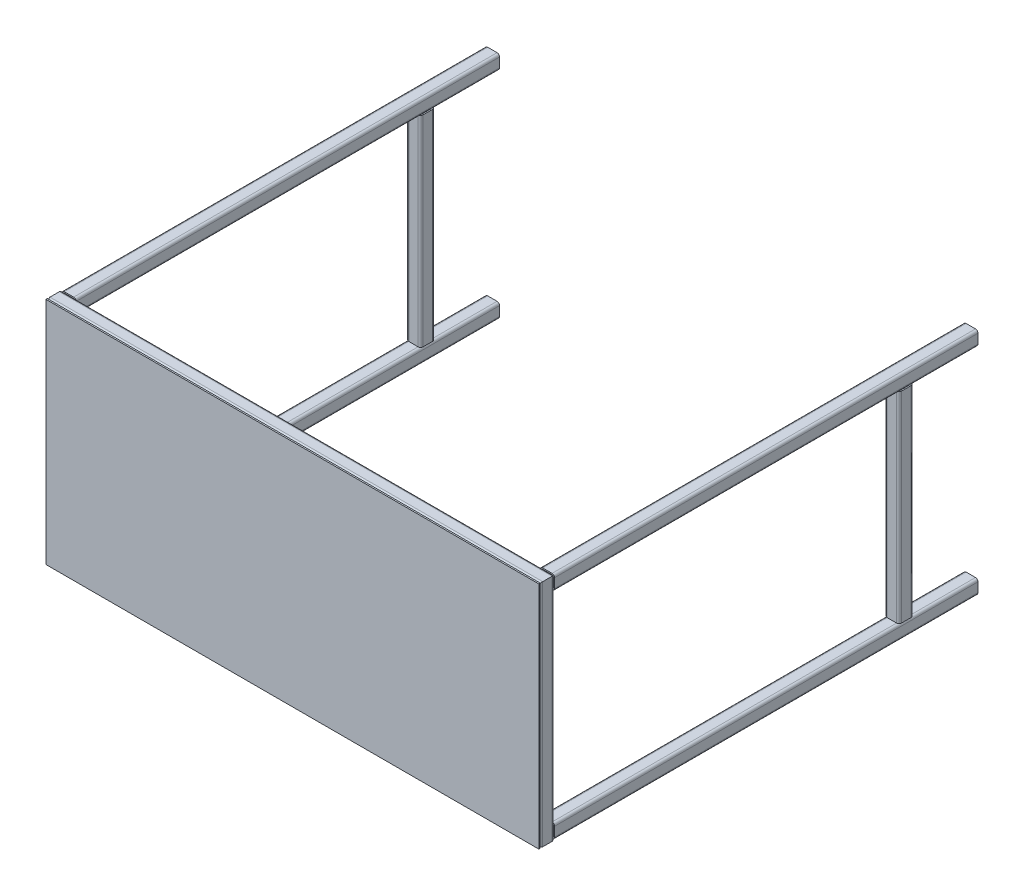
from build123d import *

# Parameters (mm, degrees)
MEMBER_1_DEPTH      = 472.213203436
MEMBER_1_DEPTH_BACK = 22.213203436
MEMBER_1_2_DEPTH    = 1044.426406871
MEMBER_1_3_DEPTH    = 494.426406871
MEMBER_1_4_DEPTH    = 1044.426406871
MEMBER_2_DEPTH      = 900
MEMBER_2_2_DEPTH    = 900
MEMBER_2_3_DEPTH    = 900
MEMBER_2_4_DEPTH    = 900
SKETCH_6_W          = 1030
SKETCH_6_H          = 480
EXTRUDE_1_DEPTH     = 3
MEMBER_3_DEPTH      = 450
MEMBER_3_2_DEPTH    = 450


with BuildPart() as part:
    # Sketch1 → Member 1 (new, two sides: drawn at the far end of the back side and taken through both)
    with BuildSketch(Plane(origin=(500, -225, 0), x_dir=(-1, 0, 0), z_dir=(0, 1, 0)).offset(-MEMBER_1_DEPTH_BACK)):
        with BuildLine():
            Line((-9.8, -15), (9.8, -15))
            ThreePointArc((9.8, -15), (13.476955262, -13.476955262), (15, -9.8))
            Line((15, -9.8), (15, 9.8))
            ThreePointArc((15, 9.8), (13.476955262, 13.476955262), (9.8, 15))
            Line((9.8, 15), (-9.8, 15))
            ThreePointArc((-9.8, 15), (-13.476955262, 13.476955262), (-15, 9.8))
            Line((-15, 9.8), (-15, -9.8))
            ThreePointArc((-15, -9.8), (-13.476955262, -13.476955262), (-9.8, -15))
        make_face()
        with BuildLine():
            Line((-9.8, -12.4), (9.8, -12.4))
            ThreePointArc((9.8, -12.4), (11.638477631, -11.638477631), (12.4, -9.8))
            Line((12.4, -9.8), (12.4, 9.8))
            ThreePointArc((12.4, 9.8), (11.638477631, 11.638477631), (9.8, 12.4))
            Line((9.8, 12.4), (-9.8, 12.4))
            ThreePointArc((-9.8, 12.4), (-11.638477631, 11.638477631), (-12.4, 9.8))
            Line((-12.4, 9.8), (-12.4, -9.8))
            ThreePointArc((-12.4, -9.8), (-11.638477631, -11.638477631), (-9.8, -12.4))
        make_face(mode=Mode.SUBTRACT)
    extrude(amount=MEMBER_1_DEPTH + MEMBER_1_DEPTH_BACK)

    # Member 1 mitre 1
    split(bisect_by=Plane(origin=(500, -225, 0), x_dir=(-0.707106781, 0.707106781, 0), z_dir=(0.707106781, 0.707106781, 0)), keep=Keep.TOP)

    # Member 1 mitre 2
    split(bisect_by=Plane(origin=(500, 225, 0), x_dir=(0.707106781, 0.707106781, 0), z_dir=(0.707106781, -0.707106781, 0)), keep=Keep.TOP)


with BuildPart() as body_2:
    # Sketch1 on segment 2 (carried to segment 2) → Member 1 2 (new body)
    with BuildSketch(Plane(origin=(522.213203436, 225, 0), x_dir=(0, -1, 0), z_dir=(-1, 0, 0))):
        with BuildLine():
            Line((-9.8, -15), (9.8, -15))
            ThreePointArc((9.8, -15), (13.476955262, -13.476955262), (15, -9.8))
            Line((15, -9.8), (15, 9.8))
            ThreePointArc((15, 9.8), (13.476955262, 13.476955262), (9.8, 15))
            Line((9.8, 15), (-9.8, 15))
            ThreePointArc((-9.8, 15), (-13.476955262, 13.476955262), (-15, 9.8))
            Line((-15, 9.8), (-15, -9.8))
            ThreePointArc((-15, -9.8), (-13.476955262, -13.476955262), (-9.8, -15))
        make_face()
        with BuildLine():
            Line((-9.8, -12.4), (9.8, -12.4))
            ThreePointArc((9.8, -12.4), (11.638477631, -11.638477631), (12.4, -9.8))
            Line((12.4, -9.8), (12.4, 9.8))
            ThreePointArc((12.4, 9.8), (11.638477631, 11.638477631), (9.8, 12.4))
            Line((9.8, 12.4), (-9.8, 12.4))
            ThreePointArc((-9.8, 12.4), (-11.638477631, 11.638477631), (-12.4, 9.8))
            Line((-12.4, 9.8), (-12.4, -9.8))
            ThreePointArc((-12.4, -9.8), (-11.638477631, -11.638477631), (-9.8, -12.4))
        make_face(mode=Mode.SUBTRACT)
    extrude(amount=MEMBER_1_2_DEPTH)

    # Member 1 2 mitre 1
    split(bisect_by=Plane(origin=(500, 225, 0), x_dir=(-0.707106781, -0.707106781, 0), z_dir=(-0.707106781, 0.707106781, 0)), keep=Keep.TOP)

    # Member 1 2 mitre 2
    split(bisect_by=Plane(origin=(-500, 225, 0), x_dir=(-0.707106781, 0.707106781, 0), z_dir=(0.707106781, 0.707106781, 0)), keep=Keep.TOP)


with BuildPart() as body_3:
    # Sketch1 on segment 3 (carried to segment 3) → Member 1 3 (new body)
    with BuildSketch(Plane(origin=(-500, 247.213203436, 0), x_dir=(1, 0, 0), z_dir=(0, -1, 0))):
        with BuildLine():
            Line((-9.8, -15), (9.8, -15))
            ThreePointArc((9.8, -15), (13.476955262, -13.476955262), (15, -9.8))
            Line((15, -9.8), (15, 9.8))
            ThreePointArc((15, 9.8), (13.476955262, 13.476955262), (9.8, 15))
            Line((9.8, 15), (-9.8, 15))
            ThreePointArc((-9.8, 15), (-13.476955262, 13.476955262), (-15, 9.8))
            Line((-15, 9.8), (-15, -9.8))
            ThreePointArc((-15, -9.8), (-13.476955262, -13.476955262), (-9.8, -15))
        make_face()
        with BuildLine():
            Line((-9.8, -12.4), (9.8, -12.4))
            ThreePointArc((9.8, -12.4), (11.638477631, -11.638477631), (12.4, -9.8))
            Line((12.4, -9.8), (12.4, 9.8))
            ThreePointArc((12.4, 9.8), (11.638477631, 11.638477631), (9.8, 12.4))
            Line((9.8, 12.4), (-9.8, 12.4))
            ThreePointArc((-9.8, 12.4), (-11.638477631, 11.638477631), (-12.4, 9.8))
            Line((-12.4, 9.8), (-12.4, -9.8))
            ThreePointArc((-12.4, -9.8), (-11.638477631, -11.638477631), (-9.8, -12.4))
        make_face(mode=Mode.SUBTRACT)
    extrude(amount=MEMBER_1_3_DEPTH)

    # Member 1 3 mitre 1
    split(bisect_by=Plane(origin=(-500, -225, 0), x_dir=(-0.707106781, -0.707106781, 0), z_dir=(-0.707106781, 0.707106781, 0)), keep=Keep.TOP)

    # Member 1 3 mitre 2
    split(bisect_by=Plane(origin=(-500, 225, 0), x_dir=(0.707106781, -0.707106781, 0), z_dir=(-0.707106781, -0.707106781, 0)), keep=Keep.TOP)


with BuildPart() as body_4:
    # Sketch1 on segment 4 (carried to segment 4) → Member 1 4 (new body)
    with BuildSketch(Plane(origin=(-522.213203436, -225, 0), x_dir=(0, 1, 0), z_dir=(1, 0, 0))):
        with BuildLine():
            Line((-9.8, -15), (9.8, -15))
            ThreePointArc((9.8, -15), (13.476955262, -13.476955262), (15, -9.8))
            Line((15, -9.8), (15, 9.8))
            ThreePointArc((15, 9.8), (13.476955262, 13.476955262), (9.8, 15))
            Line((9.8, 15), (-9.8, 15))
            ThreePointArc((-9.8, 15), (-13.476955262, 13.476955262), (-15, 9.8))
            Line((-15, 9.8), (-15, -9.8))
            ThreePointArc((-15, -9.8), (-13.476955262, -13.476955262), (-9.8, -15))
        make_face()
        with BuildLine():
            Line((-9.8, -12.4), (9.8, -12.4))
            ThreePointArc((9.8, -12.4), (11.638477631, -11.638477631), (12.4, -9.8))
            Line((12.4, -9.8), (12.4, 9.8))
            ThreePointArc((12.4, 9.8), (11.638477631, 11.638477631), (9.8, 12.4))
            Line((9.8, 12.4), (-9.8, 12.4))
            ThreePointArc((-9.8, 12.4), (-11.638477631, 11.638477631), (-12.4, 9.8))
            Line((-12.4, 9.8), (-12.4, -9.8))
            ThreePointArc((-12.4, -9.8), (-11.638477631, -11.638477631), (-9.8, -12.4))
        make_face(mode=Mode.SUBTRACT)
    extrude(amount=MEMBER_1_4_DEPTH)

    # Member 1 4 mitre 1
    split(bisect_by=Plane(origin=(500, -225, 0), x_dir=(0.707106781, -0.707106781, 0), z_dir=(-0.707106781, -0.707106781, 0)), keep=Keep.TOP)

    # Member 1 4 mitre 2
    split(bisect_by=Plane(origin=(-500, -225, 0), x_dir=(0.707106781, 0.707106781, 0), z_dir=(0.707106781, -0.707106781, 0)), keep=Keep.TOP)


with BuildPart() as body_5:
    # Sketch11 → Member 2 (new body)
    with BuildSketch(Plane(origin=(500, 225, 0), x_dir=(0, 1, 0), z_dir=(0, 0, -1))):
        with BuildLine():
            Line((-9.8, -15), (9.8, -15))
            ThreePointArc((9.8, -15), (13.476955262, -13.476955262), (15, -9.8))
            Line((15, -9.8), (15, 9.8))
            ThreePointArc((15, 9.8), (13.476955262, 13.476955262), (9.8, 15))
            Line((9.8, 15), (-9.8, 15))
            ThreePointArc((-9.8, 15), (-13.476955262, 13.476955262), (-15, 9.8))
            Line((-15, 9.8), (-15, -9.8))
            ThreePointArc((-15, -9.8), (-13.476955262, -13.476955262), (-9.8, -15))
        make_face()
        with BuildLine():
            Line((-9.8, -12.4), (9.8, -12.4))
            ThreePointArc((9.8, -12.4), (11.638477631, -11.638477631), (12.4, -9.8))
            Line((12.4, -9.8), (12.4, 9.8))
            ThreePointArc((12.4, 9.8), (11.638477631, 11.638477631), (9.8, 12.4))
            Line((9.8, 12.4), (-9.8, 12.4))
            ThreePointArc((-9.8, 12.4), (-11.638477631, 11.638477631), (-12.4, 9.8))
            Line((-12.4, 9.8), (-12.4, -9.8))
            ThreePointArc((-12.4, -9.8), (-11.638477631, -11.638477631), (-9.8, -12.4))
        make_face(mode=Mode.SUBTRACT)
    extrude(amount=MEMBER_2_DEPTH)

    # Weld Trim 1 5
    split(bisect_by=Plane(origin=(0, 225.064026667, -15), x_dir=(0, 1, 0), z_dir=(0, 0, -1)), keep=Keep.TOP)


with BuildPart() as body_6:
    # Sketch11 on segment 2 (carried to segment 2) → Member 2 2 (new body)
    with BuildSketch(Plane(origin=(-500, 225, 0), x_dir=(0, 1, 0), z_dir=(0, 0, -1))):
        with BuildLine():
            Line((-9.8, -15), (9.8, -15))
            ThreePointArc((9.8, -15), (13.476955262, -13.476955262), (15, -9.8))
            Line((15, -9.8), (15, 9.8))
            ThreePointArc((15, 9.8), (13.476955262, 13.476955262), (9.8, 15))
            Line((9.8, 15), (-9.8, 15))
            ThreePointArc((-9.8, 15), (-13.476955262, 13.476955262), (-15, 9.8))
            Line((-15, 9.8), (-15, -9.8))
            ThreePointArc((-15, -9.8), (-13.476955262, -13.476955262), (-9.8, -15))
        make_face()
        with BuildLine():
            Line((-9.8, -12.4), (9.8, -12.4))
            ThreePointArc((9.8, -12.4), (11.638477631, -11.638477631), (12.4, -9.8))
            Line((12.4, -9.8), (12.4, 9.8))
            ThreePointArc((12.4, 9.8), (11.638477631, 11.638477631), (9.8, 12.4))
            Line((9.8, 12.4), (-9.8, 12.4))
            ThreePointArc((-9.8, 12.4), (-11.638477631, 11.638477631), (-12.4, 9.8))
            Line((-12.4, 9.8), (-12.4, -9.8))
            ThreePointArc((-12.4, -9.8), (-11.638477631, -11.638477631), (-9.8, -12.4))
        make_face(mode=Mode.SUBTRACT)
    extrude(amount=MEMBER_2_2_DEPTH)

    # Weld Trim 1 5
    split(bisect_by=Plane(origin=(0, 225.064026667, -15), x_dir=(0, 1, 0), z_dir=(0, 0, -1)), keep=Keep.TOP)


with BuildPart() as body_7:
    # Sketch11 on segment 3 (carried to segment 3) → Member 2 3 (new body)
    with BuildSketch(Plane(origin=(-500, -225, 0), x_dir=(0, 1, 0), z_dir=(0, 0, -1))):
        with BuildLine():
            Line((-9.8, -15), (9.8, -15))
            ThreePointArc((9.8, -15), (13.476955262, -13.476955262), (15, -9.8))
            Line((15, -9.8), (15, 9.8))
            ThreePointArc((15, 9.8), (13.476955262, 13.476955262), (9.8, 15))
            Line((9.8, 15), (-9.8, 15))
            ThreePointArc((-9.8, 15), (-13.476955262, 13.476955262), (-15, 9.8))
            Line((-15, 9.8), (-15, -9.8))
            ThreePointArc((-15, -9.8), (-13.476955262, -13.476955262), (-9.8, -15))
        make_face()
        with BuildLine():
            Line((-9.8, -12.4), (9.8, -12.4))
            ThreePointArc((9.8, -12.4), (11.638477631, -11.638477631), (12.4, -9.8))
            Line((12.4, -9.8), (12.4, 9.8))
            ThreePointArc((12.4, 9.8), (11.638477631, 11.638477631), (9.8, 12.4))
            Line((9.8, 12.4), (-9.8, 12.4))
            ThreePointArc((-9.8, 12.4), (-11.638477631, 11.638477631), (-12.4, 9.8))
            Line((-12.4, 9.8), (-12.4, -9.8))
            ThreePointArc((-12.4, -9.8), (-11.638477631, -11.638477631), (-9.8, -12.4))
        make_face(mode=Mode.SUBTRACT)
    extrude(amount=MEMBER_2_3_DEPTH)

    # Weld Trim 1 5
    split(bisect_by=Plane(origin=(0, 225.064026667, -15), x_dir=(0, 1, 0), z_dir=(0, 0, -1)), keep=Keep.TOP)


with BuildPart() as body_8:
    # Sketch11 on segment 4 (carried to segment 4) → Member 2 4 (new body)
    with BuildSketch(Plane(origin=(500, -225, 0), x_dir=(0, 1, 0), z_dir=(0, 0, -1))):
        with BuildLine():
            Line((-9.8, -15), (9.8, -15))
            ThreePointArc((9.8, -15), (13.476955262, -13.476955262), (15, -9.8))
            Line((15, -9.8), (15, 9.8))
            ThreePointArc((15, 9.8), (13.476955262, 13.476955262), (9.8, 15))
            Line((9.8, 15), (-9.8, 15))
            ThreePointArc((-9.8, 15), (-13.476955262, 13.476955262), (-15, 9.8))
            Line((-15, 9.8), (-15, -9.8))
            ThreePointArc((-15, -9.8), (-13.476955262, -13.476955262), (-9.8, -15))
        make_face()
        with BuildLine():
            Line((-9.8, -12.4), (9.8, -12.4))
            ThreePointArc((9.8, -12.4), (11.638477631, -11.638477631), (12.4, -9.8))
            Line((12.4, -9.8), (12.4, 9.8))
            ThreePointArc((12.4, 9.8), (11.638477631, 11.638477631), (9.8, 12.4))
            Line((9.8, 12.4), (-9.8, 12.4))
            ThreePointArc((-9.8, 12.4), (-11.638477631, 11.638477631), (-12.4, 9.8))
            Line((-12.4, 9.8), (-12.4, -9.8))
            ThreePointArc((-12.4, -9.8), (-11.638477631, -11.638477631), (-9.8, -12.4))
        make_face(mode=Mode.SUBTRACT)
    extrude(amount=MEMBER_2_4_DEPTH)

    # Weld Trim 1 5
    split(bisect_by=Plane(origin=(0, 225.064026667, -15), x_dir=(0, 1, 0), z_dir=(0, 0, -1)), keep=Keep.TOP)


with BuildPart() as body_9:
    # 草图6 → 凸台-拉伸1 (new body)
    with BuildSketch(Plane.XY.offset(15)):
        Rectangle(SKETCH_6_W, SKETCH_6_H)
    extrude(amount=EXTRUDE_1_DEPTH)


with BuildPart() as body_10:
    # Sketch12 → Member 3 (new body)
    with BuildSketch(Plane(origin=(500, 225, -750), x_dir=(0, 0, -1), z_dir=(0, -1, 0))):
        with BuildLine():
            Line((-9.8, -15), (9.8, -15))
            ThreePointArc((9.8, -15), (13.476955262, -13.476955262), (15, -9.8))
            Line((15, -9.8), (15, 9.8))
            ThreePointArc((15, 9.8), (13.476955262, 13.476955262), (9.8, 15))
            Line((9.8, 15), (-9.8, 15))
            ThreePointArc((-9.8, 15), (-13.476955262, 13.476955262), (-15, 9.8))
            Line((-15, 9.8), (-15, -9.8))
            ThreePointArc((-15, -9.8), (-13.476955262, -13.476955262), (-9.8, -15))
        make_face()
        with BuildLine():
            Line((-9.8, -12.4), (9.8, -12.4))
            ThreePointArc((9.8, -12.4), (11.638477631, -11.638477631), (12.4, -9.8))
            Line((12.4, -9.8), (12.4, 9.8))
            ThreePointArc((12.4, 9.8), (11.638477631, 11.638477631), (9.8, 12.4))
            Line((9.8, 12.4), (-9.8, 12.4))
            ThreePointArc((-9.8, 12.4), (-11.638477631, 11.638477631), (-12.4, 9.8))
            Line((-12.4, 9.8), (-12.4, -9.8))
            ThreePointArc((-12.4, -9.8), (-11.638477631, -11.638477631), (-9.8, -12.4))
        make_face(mode=Mode.SUBTRACT)
    extrude(amount=MEMBER_3_DEPTH)

    # Weld Trim 2 41
    split(bisect_by=Plane.XZ.offset(-210), keep=Keep.TOP)

    # Weld Trim 2 88
    split(bisect_by=Plane(origin=(0, -210, 0), x_dir=(-1, 0, 0), z_dir=(0, 1, 0)), keep=Keep.TOP)


with BuildPart() as body_11:
    # Sketch12 on segment 2 (carried to segment 2) → Member 3 2 (new body)
    with BuildSketch(Plane(origin=(-500, 225, -750), x_dir=(0, 0, -1), z_dir=(0, -1, 0))):
        with BuildLine():
            Line((-9.8, -15), (9.8, -15))
            ThreePointArc((9.8, -15), (13.476955262, -13.476955262), (15, -9.8))
            Line((15, -9.8), (15, 9.8))
            ThreePointArc((15, 9.8), (13.476955262, 13.476955262), (9.8, 15))
            Line((9.8, 15), (-9.8, 15))
            ThreePointArc((-9.8, 15), (-13.476955262, 13.476955262), (-15, 9.8))
            Line((-15, 9.8), (-15, -9.8))
            ThreePointArc((-15, -9.8), (-13.476955262, -13.476955262), (-9.8, -15))
        make_face()
        with BuildLine():
            Line((-9.8, -12.4), (9.8, -12.4))
            ThreePointArc((9.8, -12.4), (11.638477631, -11.638477631), (12.4, -9.8))
            Line((12.4, -9.8), (12.4, 9.8))
            ThreePointArc((12.4, 9.8), (11.638477631, 11.638477631), (9.8, 12.4))
            Line((9.8, 12.4), (-9.8, 12.4))
            ThreePointArc((-9.8, 12.4), (-11.638477631, 11.638477631), (-12.4, 9.8))
            Line((-12.4, 9.8), (-12.4, -9.8))
            ThreePointArc((-12.4, -9.8), (-11.638477631, -11.638477631), (-9.8, -12.4))
        make_face(mode=Mode.SUBTRACT)
    extrude(amount=MEMBER_3_2_DEPTH)

    # Weld Trim 2 41
    split(bisect_by=Plane.XZ.offset(-210), keep=Keep.TOP)

    # Weld Trim 2 88
    split(bisect_by=Plane(origin=(0, -210, 0), x_dir=(-1, 0, 0), z_dir=(0, 1, 0)), keep=Keep.TOP)


solid = Compound([part.part, body_2.part, body_3.part, body_4.part, body_5.part, body_6.part, body_7.part, body_8.part, body_9.part, body_10.part, body_11.part])
